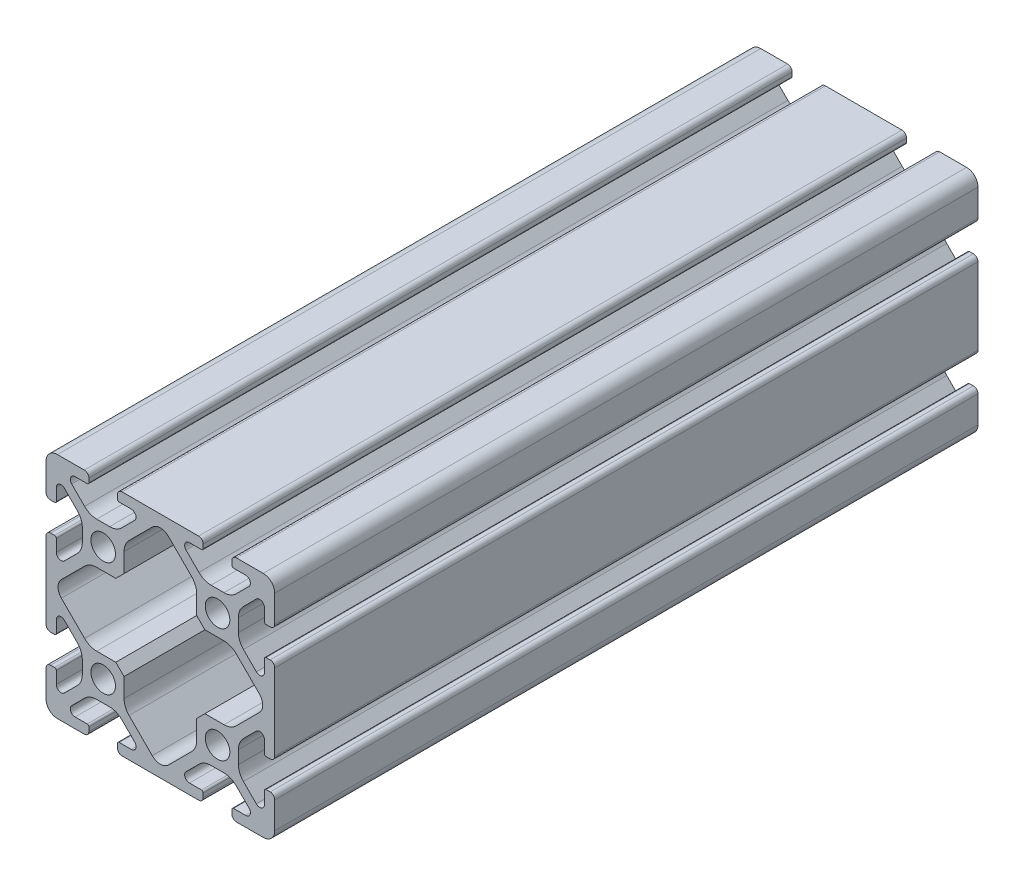
from build123d import *

# Parameters (mm, degrees)
ESQUISSE1_R      = 2.15
EXTRUSION1_DEPTH = 123


with BuildPart() as part:
    # Esquisse1 → Extrusion1 (new body)
    with BuildSketch(Plane(origin=(0, 0, 0), x_dir=(-1, 0, 0), z_dir=(0, 0, -1))):
        with BuildLine():
            Line((0, 13.3), (0, 26.7))
            ThreePointArc((0, 26.7), (-0.234314575, 27.265685425), (-0.8, 27.5))
            Line((-0.8, 27.5), (-1.5, 27.5))
            ThreePointArc((-1.5, 27.5), (-1.712132034, 27.412132034), (-1.8, 27.2))
            Line((-1.8, 27.2), (-1.8, 25.081575939))
            ThreePointArc((-1.8, 25.081575939), (-2.313345604, 24.313299949), (-3.219588924, 24.493562953))
            Line((-3.219588924, 24.493562953), (-5.471320344, 26.745294373))
            ThreePointArc((-5.471320344, 26.745294373), (-6.121638598, 27.718564419), (-6.35, 28.866614716))
            Line((-6.35, 28.866614716), (-6.35, 31.133385284))
            ThreePointArc((-6.35, 31.133385284), (-6.121638598, 32.281435581), (-5.471320344, 33.254705627))
            Line((-5.471320344, 33.254705627), (-3.219588924, 35.506437047))
            ThreePointArc((-3.219588924, 35.506437047), (-2.313345604, 35.686700051), (-1.8, 34.918424061))
            Line((-1.8, 34.918424061), (-1.8, 32.8))
            ThreePointArc((-1.8, 32.8), (-1.712132034, 32.587867966), (-1.5, 32.5))
            Line((-1.5, 32.5), (-0.8, 32.5))
            ThreePointArc((-0.8, 32.5), (-0.234314575, 32.734314575), (0, 33.3))
            Line((0, 33.3), (0, 38))
            ThreePointArc((0, 38), (-0.585786438, 39.414213562), (-2, 40))
            Line((-2, 40), (-6.7, 40))
            ThreePointArc((-6.7, 40), (-7.265685425, 39.765685425), (-7.5, 39.2))
            Line((-7.5, 39.2), (-7.5, 38.5))
            ThreePointArc((-7.5, 38.5), (-7.412132034, 38.287867966), (-7.2, 38.2))
            Line((-7.2, 38.2), (-5.081575939, 38.2))
            ThreePointArc((-5.081575939, 38.2), (-4.313299949, 37.686654396), (-4.493562953, 36.780411076))
            Line((-4.493562953, 36.780411076), (-6.745294373, 34.528679656))
            ThreePointArc((-6.745294373, 34.528679656), (-7.718564419, 33.878361402), (-8.866614716, 33.65))
            Line((-8.866614716, 33.65), (-11.133385284, 33.65))
            ThreePointArc((-11.133385284, 33.65), (-12.281435581, 33.878361402), (-13.254705627, 34.528679656))
            Line((-13.254705627, 34.528679656), (-15.506437047, 36.780411076))
            ThreePointArc((-15.506437047, 36.780411076), (-15.686700051, 37.686654396), (-14.918424061, 38.2))
            Line((-14.918424061, 38.2), (-12.8, 38.2))
            ThreePointArc((-12.8, 38.2), (-12.587867966, 38.287867966), (-12.5, 38.5))
            Line((-12.5, 38.5), (-12.5, 39.2))
            ThreePointArc((-12.5, 39.2), (-12.734314575, 39.765685425), (-13.3, 40))
            Line((-13.3, 40), (-26.7, 40))
            ThreePointArc((-26.7, 40), (-27.265685425, 39.765685425), (-27.5, 39.2))
            Line((-27.5, 39.2), (-27.5, 38.5))
            ThreePointArc((-27.5, 38.5), (-27.412132034, 38.287867966), (-27.2, 38.2))
            Line((-27.2, 38.2), (-25.081575939, 38.2))
            ThreePointArc((-25.081575939, 38.2), (-24.313299949, 37.686654396), (-24.493562953, 36.780411076))
            Line((-24.493562953, 36.780411076), (-26.745294373, 34.528679656))
            ThreePointArc((-26.745294373, 34.528679656), (-27.718564419, 33.878361402), (-28.866614716, 33.65))
            Line((-28.866614716, 33.65), (-31.133385284, 33.65))
            ThreePointArc((-31.133385284, 33.65), (-32.281435581, 33.878361402), (-33.254705627, 34.528679656))
            Line((-33.254705627, 34.528679656), (-35.506437047, 36.780411076))
            ThreePointArc((-35.506437047, 36.780411076), (-35.686700051, 37.686654396), (-34.918424061, 38.2))
            Line((-34.918424061, 38.2), (-32.8, 38.2))
            ThreePointArc((-32.8, 38.2), (-32.587867966, 38.287867966), (-32.5, 38.5))
            Line((-32.5, 38.5), (-32.5, 39.2))
            ThreePointArc((-32.5, 39.2), (-32.734314575, 39.765685425), (-33.3, 40))
            Line((-33.3, 40), (-38, 40))
            ThreePointArc((-38, 40), (-39.414213562, 39.414213562), (-40, 38))
            Line((-40, 38), (-40, 33.3))
            ThreePointArc((-40, 33.3), (-39.765685425, 32.734314575), (-39.2, 32.5))
            Line((-39.2, 32.5), (-38.5, 32.5))
            ThreePointArc((-38.5, 32.5), (-38.287867966, 32.587867966), (-38.2, 32.8))
            Line((-38.2, 32.8), (-38.2, 34.918424061))
            ThreePointArc((-38.2, 34.918424061), (-37.686654396, 35.686700051), (-36.780411076, 35.506437047))
            Line((-36.780411076, 35.506437047), (-34.528679656, 33.254705627))
            ThreePointArc((-34.528679656, 33.254705627), (-33.878361402, 32.281435581), (-33.65, 31.133385284))
            Line((-33.65, 31.133385284), (-33.65, 28.866614716))
            ThreePointArc((-33.65, 28.866614716), (-33.878361402, 27.718564419), (-34.528679656, 26.745294373))
            Line((-34.528679656, 26.745294373), (-36.780411076, 24.493562953))
            ThreePointArc((-36.780411076, 24.493562953), (-37.686654396, 24.313299949), (-38.2, 25.081575939))
            Line((-38.2, 25.081575939), (-38.2, 27.2))
            ThreePointArc((-38.2, 27.2), (-38.287867966, 27.412132034), (-38.5, 27.5))
            Line((-38.5, 27.5), (-39.2, 27.5))
            ThreePointArc((-39.2, 27.5), (-39.765685425, 27.265685425), (-40, 26.7))
            Line((-40, 26.7), (-40, 13.3))
            ThreePointArc((-40, 13.3), (-39.765685425, 12.734314575), (-39.2, 12.5))
            Line((-39.2, 12.5), (-38.5, 12.5))
            ThreePointArc((-38.5, 12.5), (-38.287867966, 12.587867966), (-38.2, 12.8))
            Line((-38.2, 12.8), (-38.2, 14.918424061))
            ThreePointArc((-38.2, 14.918424061), (-37.686654396, 15.686700051), (-36.780411076, 15.506437047))
            Line((-36.780411076, 15.506437047), (-34.528679656, 13.254705627))
            ThreePointArc((-34.528679656, 13.254705627), (-33.878361402, 12.281435581), (-33.65, 11.133385284))
            Line((-33.65, 11.133385284), (-33.65, 8.866614716))
            ThreePointArc((-33.65, 8.866614716), (-33.878361402, 7.718564419), (-34.528679656, 6.745294373))
            Line((-34.528679656, 6.745294373), (-36.780411076, 4.493562953))
            ThreePointArc((-36.780411076, 4.493562953), (-37.686654396, 4.313299949), (-38.2, 5.081575939))
            Line((-38.2, 5.081575939), (-38.2, 7.2))
            ThreePointArc((-38.2, 7.2), (-38.287867966, 7.412132034), (-38.5, 7.5))
            Line((-38.5, 7.5), (-39.2, 7.5))
            ThreePointArc((-39.2, 7.5), (-39.765685425, 7.265685425), (-40, 6.7))
            Line((-40, 6.7), (-40, 2))
            ThreePointArc((-40, 2), (-39.414213562, 0.585786438), (-38, 0))
            Line((-38, 0), (-33.3, 0))
            ThreePointArc((-33.3, 0), (-32.734314575, 0.234314575), (-32.5, 0.8))
            Line((-32.5, 0.8), (-32.5, 1.5))
            ThreePointArc((-32.5, 1.5), (-32.587867966, 1.712132034), (-32.8, 1.8))
            Line((-32.8, 1.8), (-34.918424061, 1.8))
            ThreePointArc((-34.918424061, 1.8), (-35.686700051, 2.313345604), (-35.506437047, 3.219588924))
            Line((-35.506437047, 3.219588924), (-33.254705627, 5.471320344))
            ThreePointArc((-33.254705627, 5.471320344), (-32.281435581, 6.121638598), (-31.133385284, 6.35))
            Line((-31.133385284, 6.35), (-28.866614716, 6.35))
            ThreePointArc((-28.866614716, 6.35), (-27.718564419, 6.121638598), (-26.745294373, 5.471320344))
            Line((-26.745294373, 5.471320344), (-24.493562953, 3.219588924))
            ThreePointArc((-24.493562953, 3.219588924), (-24.313299949, 2.313345604), (-25.081575939, 1.8))
            Line((-25.081575939, 1.8), (-27.2, 1.8))
            ThreePointArc((-27.2, 1.8), (-27.412132034, 1.712132034), (-27.5, 1.5))
            Line((-27.5, 1.5), (-27.5, 0.8))
            ThreePointArc((-27.5, 0.8), (-27.265685425, 0.234314575), (-26.7, 0))
            Line((-26.7, 0), (-13.3, 0))
            ThreePointArc((-13.3, 0), (-12.734314575, 0.234314575), (-12.5, 0.8))
            Line((-12.5, 0.8), (-12.5, 1.5))
            ThreePointArc((-12.5, 1.5), (-12.587867966, 1.712132034), (-12.8, 1.8))
            Line((-12.8, 1.8), (-14.918424061, 1.8))
            ThreePointArc((-14.918424061, 1.8), (-15.686700051, 2.313345604), (-15.506437047, 3.219588924))
            Line((-15.506437047, 3.219588924), (-13.254705627, 5.471320344))
            ThreePointArc((-13.254705627, 5.471320344), (-12.281435581, 6.121638598), (-11.133385284, 6.35))
            Line((-11.133385284, 6.35), (-8.866614716, 6.35))
            ThreePointArc((-8.866614716, 6.35), (-7.718564419, 6.121638598), (-6.745294373, 5.471320344))
            Line((-6.745294373, 5.471320344), (-4.493562953, 3.219588924))
            ThreePointArc((-4.493562953, 3.219588924), (-4.313299949, 2.313345604), (-5.081575939, 1.8))
            Line((-5.081575939, 1.8), (-7.2, 1.8))
            ThreePointArc((-7.2, 1.8), (-7.412132034, 1.712132034), (-7.5, 1.5))
            Line((-7.5, 1.5), (-7.5, 0.8))
            ThreePointArc((-7.5, 0.8), (-7.265685425, 0.234314575), (-6.7, 0))
            Line((-6.7, 0), (-2, 0))
            ThreePointArc((-2, 0), (-0.585786438, 0.585786438), (0, 2))
            Line((0, 2), (0, 6.7))
            ThreePointArc((0, 6.7), (-0.234314575, 7.265685425), (-0.8, 7.5))
            Line((-0.8, 7.5), (-1.5, 7.5))
            ThreePointArc((-1.5, 7.5), (-1.712132034, 7.412132034), (-1.8, 7.2))
            Line((-1.8, 7.2), (-1.8, 5.081575939))
            ThreePointArc((-1.8, 5.081575939), (-2.313345604, 4.313299949), (-3.219588924, 4.493562953))
            Line((-3.219588924, 4.493562953), (-5.471320344, 6.745294373))
            ThreePointArc((-5.471320344, 6.745294373), (-6.121638598, 7.718564419), (-6.35, 8.866614716))
            Line((-6.35, 8.866614716), (-6.35, 11.133385284))
            ThreePointArc((-6.35, 11.133385284), (-6.121638598, 12.281435581), (-5.471320344, 13.254705627))
            Line((-5.471320344, 13.254705627), (-3.219588924, 15.506437047))
            ThreePointArc((-3.219588924, 15.506437047), (-2.313345604, 15.686700051), (-1.8, 14.918424061))
            Line((-1.8, 14.918424061), (-1.8, 12.8))
            ThreePointArc((-1.8, 12.8), (-1.712132034, 12.587867966), (-1.5, 12.5))
            Line((-1.5, 12.5), (-0.8, 12.5))
            ThreePointArc((-0.8, 12.5), (-0.234314575, 12.734314575), (0, 13.3))
        make_face()
        with Locations(Location((-10, 10, 0), (0, 0, 180))):
            Circle(ESQUISSE1_R, mode=Mode.SUBTRACT)
        with Locations(Location((-10, 30, 0), (0, 0, 180))):
            Circle(ESQUISSE1_R, mode=Mode.SUBTRACT)
        with Locations(Location((-30, 10, 0), (0, 0, 180))):
            Circle(ESQUISSE1_R, mode=Mode.SUBTRACT)
        with Locations(Location((-30, 30, 0), (0, 0, 180))):
            Circle(ESQUISSE1_R, mode=Mode.SUBTRACT)
        with BuildLine():
            Line((-12.207864344, 13.650000344), (-13.649999344, 12.207864344))
            Line((-13.649999344, 12.207864344), (-13.649999344, 8.865434344))
            ThreePointArc((-13.649999344, 8.865434344), (-13.878360746, 7.717384046), (-14.528679, 6.744114))
            Line((-14.528679, 6.744114), (-18.585787, 2.687006))
            ThreePointArc((-18.585787, 2.687006), (-20.000000562, 2.101219562), (-21.414214125, 2.687006))
            Line((-21.414214125, 2.687006), (-25.471320625, 6.7441125))
            ThreePointArc((-25.471320625, 6.7441125), (-26.121638879, 7.717382546), (-26.350000281, 8.865432844))
            Line((-26.350000281, 8.865432844), (-26.350000281, 12.207864844))
            Line((-26.350000281, 12.207864844), (-27.071068281, 12.928932844))
            Line((-27.071068281, 12.928932844), (-27.792135781, 13.650000344))
            Line((-27.792135781, 13.650000344), (-31.134567781, 13.650000344))
            ThreePointArc((-31.134567781, 13.650000344), (-32.282618078, 13.878361746), (-33.255888125, 14.52868))
            Line((-33.255888125, 14.52868), (-37.312995125, 18.585787))
            ThreePointArc((-37.312995125, 18.585787), (-37.898781562, 20.000000686), (-37.31299495, 21.414214299))
            Line((-37.31299495, 21.414214299), (-33.255887863, 25.471320386))
            ThreePointArc((-33.255887863, 25.471320386), (-32.282617907, 26.121638449), (-31.134567781, 26.349999781))
            Line((-31.134567781, 26.349999781), (-27.792134781, 26.349999781))
            Line((-27.792134781, 26.349999781), (-27.071067781, 27.071067781))
            Line((-27.071067781, 27.071067781), (-26.350000281, 27.792136281))
            Line((-26.350000281, 27.792136281), (-26.350000281, 31.134565362))
            ThreePointArc((-26.350000281, 31.134565362), (-26.121638808, 32.28261583), (-25.471320363, 33.255885967))
            Line((-25.471320363, 33.255885967), (-21.414212991, 37.31299234))
            ThreePointArc((-21.414212991, 37.31299234), (-19.999999603, 37.898778603), (-18.585786215, 37.31299234))
            Line((-18.585786215, 37.31299234), (-14.528679261, 33.255886386))
            ThreePointArc((-14.528679261, 33.255886386), (-13.878360817, 32.282616249), (-13.649999344, 31.134565781))
            Line((-13.649999344, 31.134565781), (-13.649999344, 27.792135781))
            Line((-13.649999344, 27.792135781), (-12.207863344, 26.349999781))
            Line((-12.207863344, 26.349999781), (-8.865431425, 26.349999781))
            ThreePointArc((-8.865431425, 26.349999781), (-7.717381299, 26.121638449), (-6.744111343, 25.471320386))
            Line((-6.744111343, 25.471320386), (-2.687005215, 21.414215258))
            ThreePointArc((-2.687005215, 21.414215258), (-2.101218603, 20.000001645), (-2.687005041, 18.585787959))
            Line((-2.687005041, 18.585787959), (-6.744113, 14.52868))
            ThreePointArc((-6.744113, 14.52868), (-7.717383046, 13.878361746), (-8.865433344, 13.650000344))
            Line((-8.865433344, 13.650000344), (-12.207864344, 13.650000344))
        make_face(mode=Mode.SUBTRACT)
    extrude(amount=-EXTRUSION1_DEPTH)


solid = part.part
